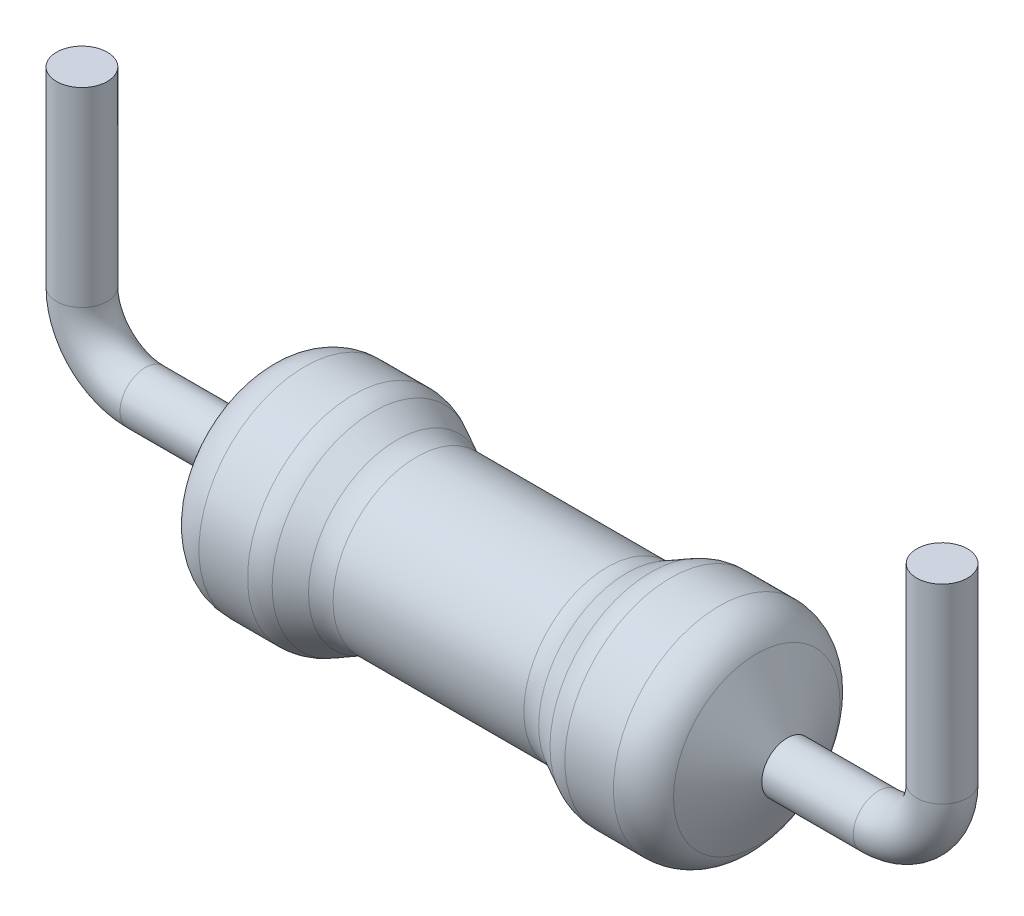
from build123d import *

# Parameters (mm, degrees)
FILLET1_R = 0.5
SKETCH4_R = 0.3


with BuildPart() as part:
    # Sketch1 → Revolve1 (revolve)
    with BuildSketch(Plane.XY, mode=Mode.PRIVATE) as revolve1_sk:
        Polygon((0, 0), (3.25, 0), (3.25, 0.3), (2.75, 1.25), (1.75, 1.25), (1.25, 0.986842105), (-1.25, 0.986842105), (-1.75, 1.25), (-2.75, 1.25), (-3.25, 0.3), (-3.25, 0), align=None)
    revolve(revolve1_sk.sketch.rotate(Axis((0, 0, 0), (1, 0, 0)), 90), axis=Axis((0, 0, 0), (1, 0, 0)))

    # Fillet1
    fillet1_edges = [part.edges().sort_by_distance(p)[0] for p in [
        (1.75, 0, -1.25),
        (2.75, 0, -1.25),
        (-2.75, 0, -1.25),
        (-1.75, 0, -1.25),
        (-1.25, 0, -0.986842105),
        (1.25, 0, -0.986842105),
    ]]
    fillet(fillet1_edges, radius=FILLET1_R)

    # Sweep1: sweep along a path in Sketch6
    with BuildLine(Plane.XY) as sweep1_path:
        Line((5.08, 3), (5.08, 0.75))
        ThreePointArc((5.08, 0.75), (4.860330086, 0.219669914), (4.33, 0))
        Line((4.33, 0), (3.25, 0))
        Line((3.25, 0), (-4.33, 0))
        ThreePointArc((-4.33, 0), (-4.860330086, 0.219669914), (-5.08, 0.75))
        Line((-5.08, 0.75), (-5.08, 3))
    # Sketch4 → Sweep1 (sweep)
    with BuildSketch(Plane(origin=(3.25, 0, 0), x_dir=(0, 0, -1), z_dir=(1, 0, 0))):
        Circle(SKETCH4_R)
    sweep(path=sweep1_path.line)


solid = part.part
